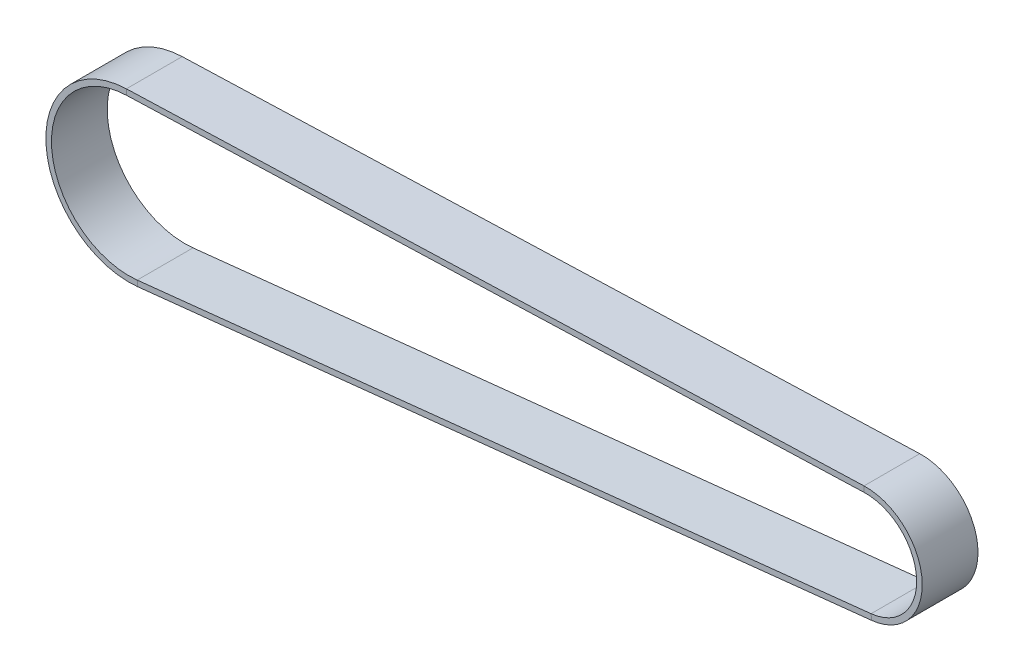
from build123d import *

# Parameters (mm, degrees)
CROQUIS3_W = 10
CROQUIS3_H = 1


with BuildPart() as part:
    # Barrer1: sweep along a path in Croquis2
    with BuildLine(Plane.XY) as barrer1_path:
        Line((0.965224878, -9.078834779), (-130.607144948, -23.067075312))
        ThreePointArc((-130.607144948, -23.067075312), (-145.948280448, -10.210409366), (-132.546701076, 4.657070851))
        Line((-132.546701076, 4.657070851), (-0.308284467, 9.124793734))
        ThreePointArc((-0.308284467, 9.124793734), (9.107739315, 0.637169184), (0.965224878, -9.078834779))
    # Croquis3 → Barrer1 (sweep)
    with BuildSketch(Plane(origin=(-0.308284467, 0, 0), x_dir=(0, 0, -1), z_dir=(1, 0, 0))):
        with Locations((0, 9.624793734)):
            Rectangle(CROQUIS3_W, CROQUIS3_H)
    sweep(path=barrer1_path.line)


solid = part.part
